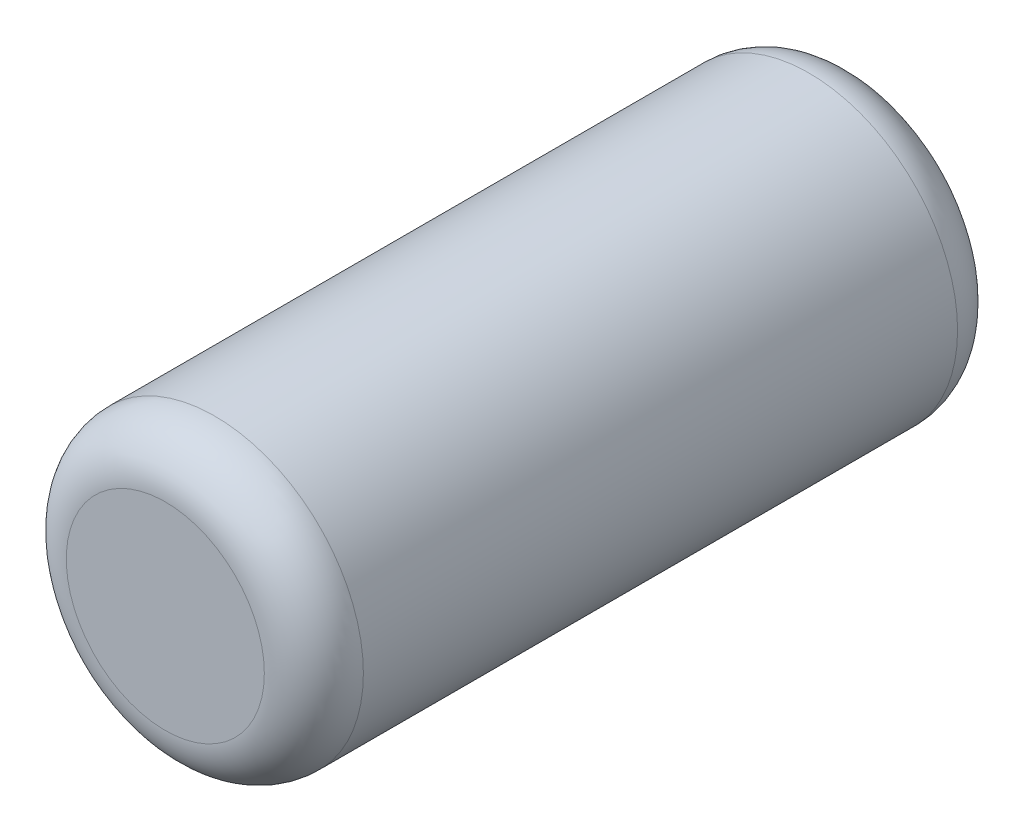
from build123d import *

# Parameters (mm, degrees)
SKETCH_1_R      = 1.5
EXTRUDE_1_DEPTH = 7
FILLET_1_R      = 0.5


with BuildPart() as part:
    # 草图1 → 凸台-拉伸1 (new body)
    with BuildSketch(Plane.XY):
        Circle(SKETCH_1_R)
    extrude(amount=EXTRUDE_1_DEPTH)

    # 圆角1
    fillet_1_edges = [part.edges().sort_by_distance(p)[0] for p in [
        (-1.5, 0, 0),
        (-1.5, 0, 7),
    ]]
    fillet(fillet_1_edges, radius=FILLET_1_R)


solid = part.part
